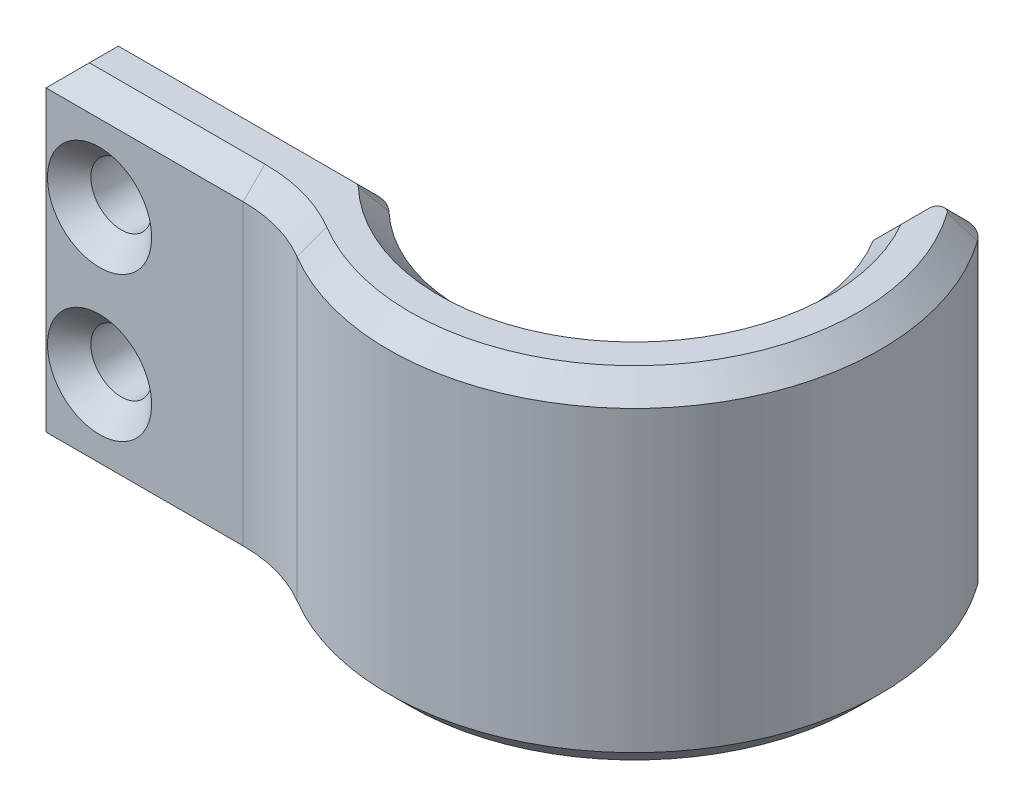
from build123d import *

# Parameters (mm, degrees)
CROQUIS1_W                          = 15.5
CROQUIS1_H                          = 23.6
CROQUIS1_R                          = 2.1
SALIENTE_EXTRUIR1_DEPTH             = 5
SALIENTE_EXTRUIR2_REACH             = 40.26
SALIENTE_EXTRUIR2_DIRECTION_2_REACH = 40.26
REDONDEO1_R                         = 2
REDONDEO2_R                         = 10
CHAFL_N1_SIZE                       = 1.5
CHAFL_N2_SIZE                       = 1.5


with BuildPart() as part:
    # Croquis1 → Saliente-Extruir1 (new body)
    with BuildSketch(Plane.XY):
        with Locations((28.3, 0)):
            Rectangle(CROQUIS1_W, CROQUIS1_H)
        with Locations((24.250000128, -5)):
            Circle(CROQUIS1_R, mode=Mode.SUBTRACT)
        with Locations((24.250000128, 5)):
            Circle(CROQUIS1_R, mode=Mode.SUBTRACT)
    extrude(amount=SALIENTE_EXTRUIR1_DEPTH)

    # Saliente-Extruir2: up to this face of the body (flat: up to its plane)
    saliente_extruir2_end = Plane(part.part.faces().sort_by_distance((28.3, -11.8, 2.5))[0])
    # Croquis2 → Saliente-Extruir2 (add, up to the picked face)
    with BuildSketch(Plane(origin=(0, 0, 0), x_dir=(1, 0, 0), z_dir=(0, 1, 0)), mode=Mode.PRIVATE) as saliente_extruir2_sk1:
        with BuildLine():
            ThreePointArc((39.254957851, 0), (55.312581622, -1.388967795), (58.268482288, 14.455247679))
            Line((58.268482288, 14.455247679), (58.268482288, 21.749894336))
            ThreePointArc((58.268482288, 21.749894336), (61.427658114, -2.326136764), (37.292908876, -5))
            Line((37.292908876, -5), (36.05, -5))
            Line((36.05, -5), (36.05, 0))
            Line((36.05, 0), (39.254957851, 0))
        make_face()
    saliente_extruir2_tool1 = split(extrude(saliente_extruir2_sk1.sketch, amount=-SALIENTE_EXTRUIR2_REACH, mode=Mode.PRIVATE), bisect_by=saliente_extruir2_end, keep=Keep.BOTH, mode=Mode.PRIVATE)
    add(saliente_extruir2_tool1.solids().sort_by(Axis((55.567672, 0, 1.724497), (0, -1, 0)))[0])

    # Saliente-Extruir2 direction 2: up to this face of the body (flat: up to its plane)
    saliente_extruir2_direction_2_end = Plane(part.part.faces().sort_by_distance((28.3, 11.8, 2.5))[0])
    # Croquis2 → Saliente-Extruir2 direction 2 (add, up to the picked face)
    with BuildSketch(Plane(origin=(0, 0, 0), x_dir=(1, 0, 0), z_dir=(0, 1, 0)), mode=Mode.PRIVATE) as saliente_extruir2_direction_2_sk1:
        with BuildLine():
            ThreePointArc((39.254957851, 0), (55.312581622, -1.388967795), (58.268482288, 14.455247679))
            Line((58.268482288, 14.455247679), (58.268482288, 21.749894336))
            ThreePointArc((58.268482288, 21.749894336), (61.427658114, -2.326136764), (37.292908876, -5))
            Line((37.292908876, -5), (36.05, -5))
            Line((36.05, -5), (36.05, 0))
            Line((36.05, 0), (39.254957851, 0))
        make_face()
    saliente_extruir2_direction_2_tool1 = split(extrude(saliente_extruir2_direction_2_sk1.sketch, amount=SALIENTE_EXTRUIR2_DIRECTION_2_REACH, mode=Mode.PRIVATE), bisect_by=saliente_extruir2_direction_2_end, keep=Keep.BOTH, mode=Mode.PRIVATE)
    add(saliente_extruir2_direction_2_tool1.solids().sort_by(Axis((55.567672, 0, 1.724497), (0, 1, 0)))[0])

    # Redondeo1
    redondeo1_edges = [part.edges().sort_by_distance(p)[0] for p in [
        (58.268482288, 0, -21.749894336),
        (39.254957851, 0, 0),
    ]]
    fillet(redondeo1_edges, radius=REDONDEO1_R)

    # Redondeo2
    redondeo2_edges = [part.edges().sort_by_distance(p)[0] for p in [
        (37.292908876, 0, 5),
    ]]
    fillet(redondeo2_edges, radius=REDONDEO2_R)

    # Chaflán1
    chafl_n1_edges = [part.edges().sort_by_distance(p)[0] for p in [
        (58.268482288, 11.8, -15.660048739),
        (55.615767212, -11.8, 1.150684381),
        (58.268482288, -11.8, -15.660048739),
        (55.615767212, 11.8, 1.150684381),
        (29.486018705, 11.8, 0),
        (60.537424453, 11.8, 3.37157131),
        (59.659492117, 11.8, -18.769877613),
        (39.162329274, 11.8, 0.142052757),
        (60.537424453, -11.8, 3.37157131),
        (59.659492117, -11.8, -18.769877613),
        (39.162329274, -11.8, 0.142052757),
        (27.363871837, 11.8, 5),
        (36.843099013, 11.8, 5.361749074),
        (36.843099013, -11.8, 5.361749074),
        (29.486018705, -11.8, 0),
        (27.363871837, -11.8, 5),
        (20.55, 11.8, 2.5),
        (20.55, -11.8, 2.5),
    ]]
    chamfer(chafl_n1_edges, length=CHAFL_N1_SIZE)

    # Chaflán2
    chafl_n2_edges = [part.edges().sort_by_distance(p)[0] for p in [
        (22.150000128, -5, 5),
        (22.150000128, 5, 5),
    ]]
    chamfer(chafl_n2_edges, length=CHAFL_N2_SIZE)


solid = part.part
